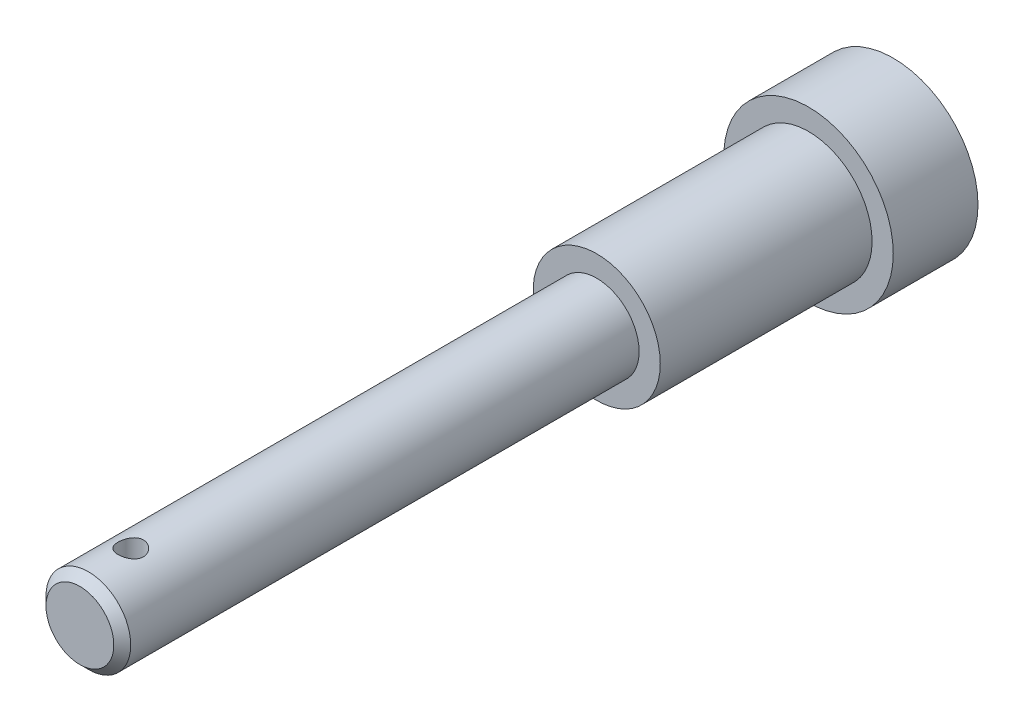
from build123d import *

# Parameters (mm, degrees)
SKETCH1_R           = 20
BOSS_EXTRUDE1_DEPTH = 20
SKETCH2_R           = 15
BOSS_EXTRUDE2_DEPTH = 50
SKETCH3_R           = 10
BOSS_EXTRUDE3_DEPTH = 120
SKETCH6_R           = 3
CUT_EXTRUDE1_DEPTH  = 22


with BuildPart() as part:
    # Sketch1 → Boss-Extrude1 (new body)
    with BuildSketch(Plane.XY):
        Circle(SKETCH1_R)
    extrude(amount=BOSS_EXTRUDE1_DEPTH)

    # Sketch2 → Boss-Extrude2 (add)
    with BuildSketch(Plane.XY.offset(20)):
        Circle(SKETCH2_R)
    extrude(amount=BOSS_EXTRUDE2_DEPTH)

    # Sketch3 → Boss-Extrude3 (add)
    with BuildSketch(Plane.XY.offset(70)):
        Circle(SKETCH3_R)
    extrude(amount=BOSS_EXTRUDE3_DEPTH)

    # Sketch5 → Revolve1 (revolve)
    with BuildSketch(Plane(origin=(0, 0, 0), x_dir=(0, 0, -1), z_dir=(1, 0, 0)), mode=Mode.PRIVATE) as revolve1_sk:
        Polygon((-190, 0), (-192, 0), (-192, -8), (-190, -10), align=None)
    revolve(revolve1_sk.sketch.rotate(Axis((0, 0, -30.365330672), (0, 0, 1)), 270), axis=Axis((0, 0, -30.365330672), (0, 0, 1)))

    # Sketch6 → Cut-Extrude1 (cut, symmetric)
    with BuildSketch(Plane(origin=(0, 0, 0), x_dir=(1, 0, 0), z_dir=(0, 1, 0))):
        with Locations(Location((0, -180, 0), (0, 0, 270))):
            Circle(SKETCH6_R)
    extrude(amount=CUT_EXTRUDE1_DEPTH, both=True, mode=Mode.SUBTRACT)


solid = part.part
